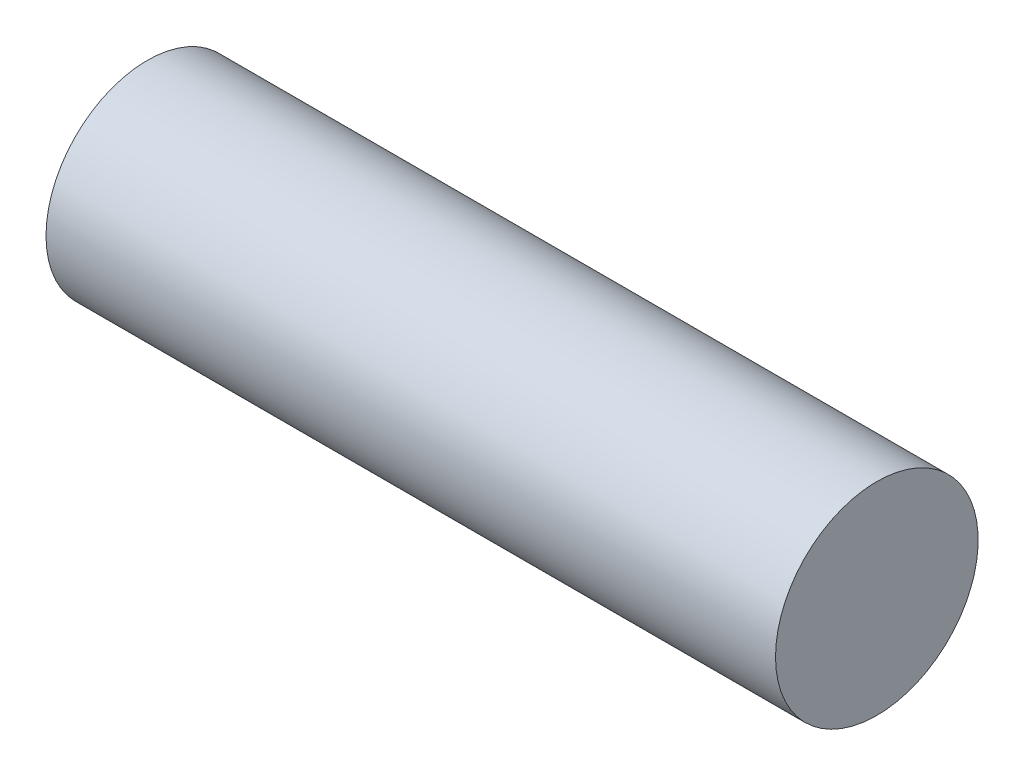
from build123d import *

# Parameters (mm, degrees)
SKETCH1_R           = 50
BOSS_EXTRUDE1_DEPTH = 360


with BuildPart() as part:
    # Sketch1 → Boss-Extrude1 (new body)
    with BuildSketch(Plane(origin=(0, 0, 0), x_dir=(0, 0, -1), z_dir=(1, 0, 0))):
        with Locations(Location((0, 0, 0), (0, 0, 180))):
            Circle(SKETCH1_R)
    extrude(amount=BOSS_EXTRUDE1_DEPTH)


solid = part.part
